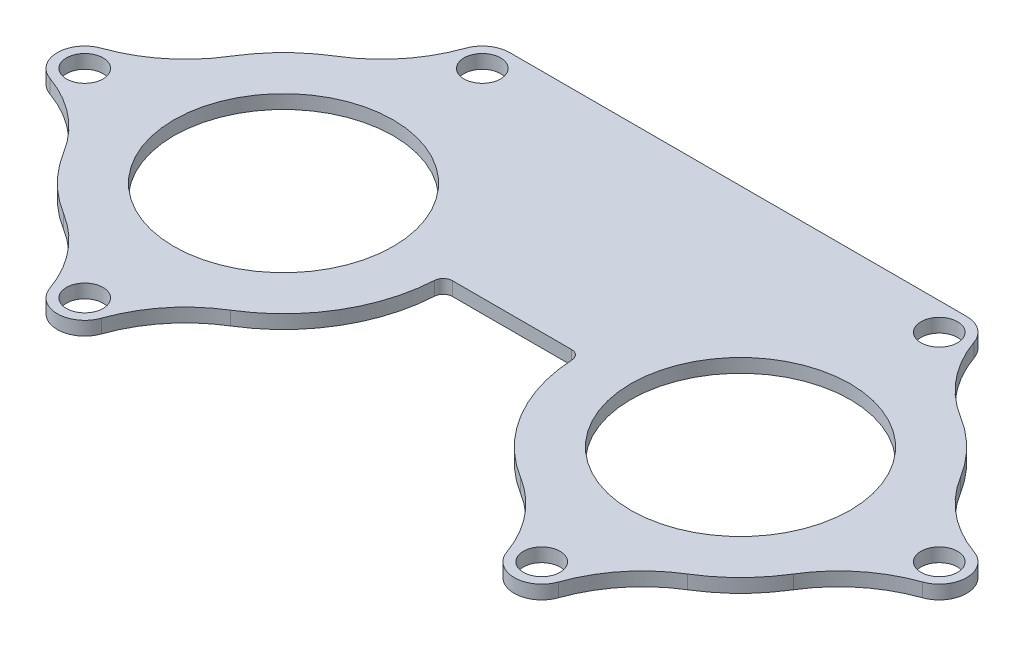
from build123d import *

# Parameters (mm, degrees)
SKETCH_1_R      = 2
SKETCH_1_R_2    = 12
EXTRUDE_1_DEPTH = 1.5
FILLET_1_R      = 1


with BuildPart() as part:
    # ｽｹｯﾁ1 → ﾎﾞｽ - 押し出し1 (new body)
    with BuildSketch(Plane(origin=(0, 0, 0), x_dir=(1, 0, 0), z_dir=(0, 1, 0))):
        with BuildLine():
            Line((50, 24.75), (0, 24.75))
            ThreePointArc((0, 24.75), (-1.735055234, 24.197362526), (-2.830872774, 22.743055556))
            ThreePointArc((-2.830872774, 22.743055556), (-5.313420016, 18.286619233), (-9.145896655, 14.919871795))
            ThreePointArc((-9.145896655, 14.919871795), (-12.374368671, 12.374368671), (-14.919871795, 9.145896655))
            ThreePointArc((-14.919871795, 9.145896655), (-18.286619233, 5.313420016), (-22.743055556, 2.830872774))
            ThreePointArc((-22.743055556, 2.830872774), (-24.75, 0), (-22.743055556, -2.830872774))
            ThreePointArc((-22.743055556, -2.830872774), (-18.286619233, -5.313420016), (-14.919871795, -9.145896655))
            ThreePointArc((-14.919871795, -9.145896655), (-12.374368671, -12.374368671), (-9.145896655, -14.919871795))
            ThreePointArc((-9.145896655, -14.919871795), (-5.313420016, -18.286619233), (-2.830872774, -22.743055556))
            ThreePointArc((-2.830872774, -22.743055556), (0, -24.75), (2.830872774, -22.743055556))
            ThreePointArc((2.830872774, -22.743055556), (5.313420016, -18.286619233), (9.145896655, -14.919871795))
            ThreePointArc((9.145896655, -14.919871795), (15.269302398, -8.54976048), (17.5, 0))
            Line((17.5, 0), (32.5, 0))
            ThreePointArc((32.5, 0), (34.730697602, -8.54976048), (40.854103345, -14.919871795))
            ThreePointArc((40.854103345, -14.919871795), (44.686579984, -18.286619233), (47.169127226, -22.743055556))
            ThreePointArc((47.169127226, -22.743055556), (50, -24.75), (52.830872774, -22.743055556))
            ThreePointArc((52.830872774, -22.743055556), (55.313420016, -18.286619233), (59.145896655, -14.919871795))
            ThreePointArc((59.145896655, -14.919871795), (62.374368671, -12.374368671), (64.919871795, -9.145896655))
            ThreePointArc((64.919871795, -9.145896655), (68.286619233, -5.313420016), (72.743055556, -2.830872774))
            ThreePointArc((72.743055556, -2.830872774), (74.75, 0), (72.743055556, 2.830872774))
            ThreePointArc((72.743055556, 2.830872774), (68.286619233, 5.313420016), (64.919871795, 9.145896655))
            ThreePointArc((64.919871795, 9.145896655), (62.374368671, 12.374368671), (59.145896655, 14.919871795))
            ThreePointArc((59.145896655, 14.919871795), (55.313420016, 18.286619233), (52.830872774, 22.743055556))
            ThreePointArc((52.830872774, 22.743055556), (51.735055234, 24.197362526), (50, 24.75))
        make_face()
        with Locations(Location((0, 21.75, 0), (0, 0, 270))):
            Circle(SKETCH_1_R, mode=Mode.SUBTRACT)
        with Locations(Location((50, 21.75, 0), (0, 0, 270))):
            Circle(SKETCH_1_R, mode=Mode.SUBTRACT)
        with Locations(Location((0, 0, 0), (0, 0, 270))):
            Circle(SKETCH_1_R_2, mode=Mode.SUBTRACT)
        with Locations(Location((50, 0, 0), (0, 0, 270))):
            Circle(SKETCH_1_R_2, mode=Mode.SUBTRACT)
        with Locations(Location((-21.75, 0, 0), (0, 0, 270))):
            Circle(SKETCH_1_R, mode=Mode.SUBTRACT)
        with Locations(Location((71.75, 0, 0), (0, 0, 270))):
            Circle(SKETCH_1_R, mode=Mode.SUBTRACT)
        with Locations(Location((0, -21.75, 0), (0, 0, 270))):
            Circle(SKETCH_1_R, mode=Mode.SUBTRACT)
        with Locations(Location((50, -21.75, 0), (0, 0, 270))):
            Circle(SKETCH_1_R, mode=Mode.SUBTRACT)
    extrude(amount=EXTRUDE_1_DEPTH)

    # ﾌｨﾚｯﾄ1
    fillet_1_edges = [part.edges().sort_by_distance(p)[0] for p in [
        (32.5, 0.75, 0),
        (17.5, 0.75, 0),
    ]]
    fillet(fillet_1_edges, radius=FILLET_1_R)


solid = part.part
